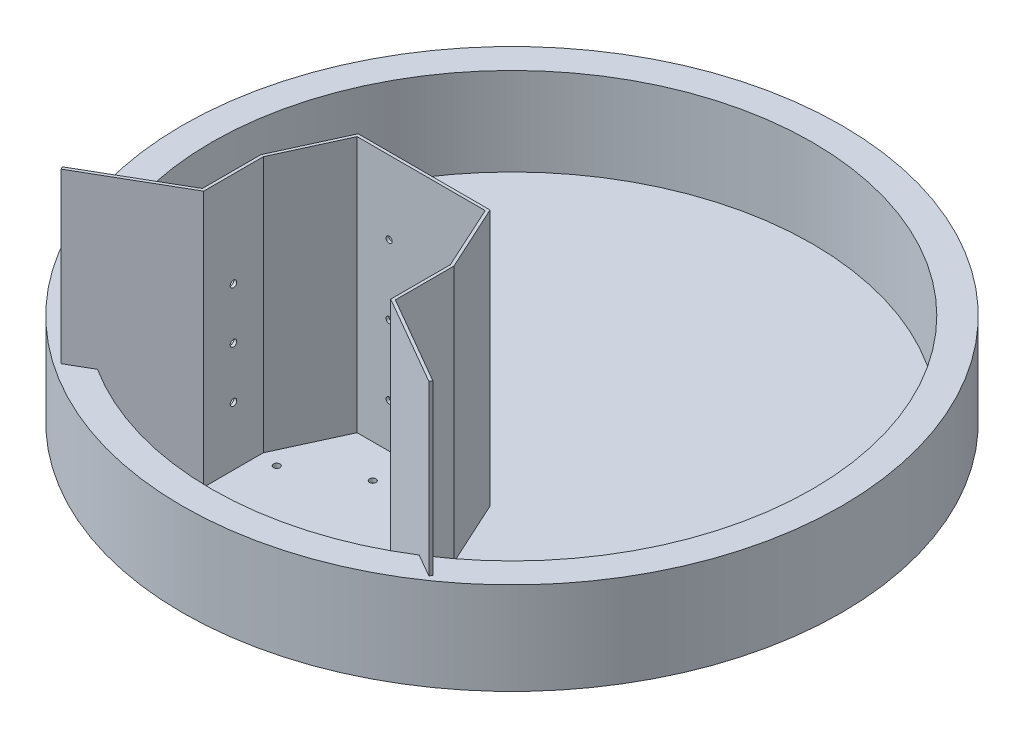
from build123d import *

# Parameters (mm, degrees)
EXTRUDE_THIN1_DEPTH = 175
CUT_EXTRUDE1_REACH  = 249.104
SKETCH2_R           = 2.1
CUT_EXTRUDE2_REACH  = 224.775
SKETCH3_R           = 2.25
SKETCH4_R           = 225
BOSS_EXTRUDE1_DEPTH = 3
SKETCH5_R           = 2.2
CUT_EXTRUDE3_DEPTH  = 3
BOSS_EXTRUDE2_START = 60
SKETCH6_R           = 225
SKETCH6_R_2         = 205
BOSS_EXTRUDE2_DEPTH = 60


with BuildPart() as part:
    # Sketch1 → Extrude-Thin1 (new body)
    with BuildSketch(Plane(origin=(0, 0, 0), x_dir=(1, 0, 0), z_dir=(0, 1, 0))):
        Polygon((0, 0), (-45, 0), (-65.833333333, -45.452967144), (-65.833333333, -85.452967144), (-126.455111598, -120.452967144), (-125.455111598, -122.185017952), (-63.833333333, -86.607667683), (-63.833333333, -45.889482298), (-43.716622104, -2), (0, -2), align=None)
    extrude_thin1 = extrude(amount=EXTRUDE_THIN1_DEPTH)

    # Sketch2 → Cut-Extrude1 (cut, up to next)
    with BuildSketch(Plane.XY.offset(2), mode=Mode.PRIVATE) as cut_extrude1_sk1:
        with Locations((-21.858311052, 30)):
            Circle(SKETCH2_R)
    cut_extrude1_tool1 = extrude(cut_extrude1_sk1.sketch, amount=-CUT_EXTRUDE1_REACH, mode=Mode.PRIVATE) & part.part
    # Sketch2 → Cut-Extrude1 (cut, up to next)
    with BuildSketch(Plane.XY.offset(2), mode=Mode.PRIVATE) as cut_extrude1_sk2:
        with Locations((-21.858311052, 77.5)):
            Circle(SKETCH2_R)
    cut_extrude1_tool2 = extrude(cut_extrude1_sk2.sketch, amount=-CUT_EXTRUDE1_REACH, mode=Mode.PRIVATE) & part.part
    # Sketch2 → Cut-Extrude1 (cut, up to next)
    with BuildSketch(Plane.XY.offset(2), mode=Mode.PRIVATE) as cut_extrude1_sk3:
        with Locations((-21.858311052, 125)):
            Circle(SKETCH2_R)
    cut_extrude1_tool3 = extrude(cut_extrude1_sk3.sketch, amount=-CUT_EXTRUDE1_REACH, mode=Mode.PRIVATE) & part.part
    cut_extrude1_1 = cut_extrude1_tool1.solids().sort_by_distance((-21.858311, 30, 2))[0]
    add(cut_extrude1_1, mode=Mode.SUBTRACT)
    cut_extrude1_2 = cut_extrude1_tool2.solids().sort_by_distance((-21.858311, 77.5, 2))[0]
    add(cut_extrude1_2, mode=Mode.SUBTRACT)
    cut_extrude1_3 = cut_extrude1_tool3.solids().sort_by_distance((-21.858311, 125, 2))[0]
    add(cut_extrude1_3, mode=Mode.SUBTRACT)
    cut_extrude1 = cut_extrude1_1 + cut_extrude1_2 + cut_extrude1_3  # Cut-Extrude1 as one shape, for the pattern or mirror that repeats it

    # Sketch3 → Cut-Extrude2 (cut, up to next)
    with BuildSketch(Plane(origin=(-63.833333333, 0, 0), x_dir=(0, 0, -1), z_dir=(1, 0, 0)), mode=Mode.PRIVATE) as cut_extrude2_sk1:
        with Locations((-66.248574991, 40)):
            Circle(SKETCH3_R)
    cut_extrude2_tool1 = extrude(cut_extrude2_sk1.sketch, amount=-CUT_EXTRUDE2_REACH, mode=Mode.PRIVATE) & part.part
    # Sketch3 → Cut-Extrude2 (cut, up to next)
    with BuildSketch(Plane(origin=(-63.833333333, 0, 0), x_dir=(0, 0, -1), z_dir=(1, 0, 0)), mode=Mode.PRIVATE) as cut_extrude2_sk2:
        with Locations((-66.248574991, 75)):
            Circle(SKETCH3_R)
    cut_extrude2_tool2 = extrude(cut_extrude2_sk2.sketch, amount=-CUT_EXTRUDE2_REACH, mode=Mode.PRIVATE) & part.part
    # Sketch3 → Cut-Extrude2 (cut, up to next)
    with BuildSketch(Plane(origin=(-63.833333333, 0, 0), x_dir=(0, 0, -1), z_dir=(1, 0, 0)), mode=Mode.PRIVATE) as cut_extrude2_sk3:
        with Locations((-66.248574991, 110)):
            Circle(SKETCH3_R)
    cut_extrude2_tool3 = extrude(cut_extrude2_sk3.sketch, amount=-CUT_EXTRUDE2_REACH, mode=Mode.PRIVATE) & part.part
    cut_extrude2_1 = cut_extrude2_tool1.solids().sort_by_distance((-63.833333, 40, 66.248575))[0]
    add(cut_extrude2_1, mode=Mode.SUBTRACT)
    cut_extrude2_2 = cut_extrude2_tool2.solids().sort_by_distance((-63.833333, 75, 66.248575))[0]
    add(cut_extrude2_2, mode=Mode.SUBTRACT)
    cut_extrude2_3 = cut_extrude2_tool3.solids().sort_by_distance((-63.833333, 110, 66.248575))[0]
    add(cut_extrude2_3, mode=Mode.SUBTRACT)
    cut_extrude2 = cut_extrude2_1 + cut_extrude2_2 + cut_extrude2_3  # Cut-Extrude2 as one shape, for the pattern or mirror that repeats it

    # Mirror1: Extrude-Thin1, Cut-Extrude1, Cut-Extrude2 across plane
    add(extrude_thin1.mirror(Plane(origin=(0, 0, 0), x_dir=(0, 0, 1), z_dir=(1, 0, 0))))
    add(cut_extrude1.mirror(Plane(origin=(0, 0, 0), x_dir=(0, 0, 1), z_dir=(1, 0, 0))), mode=Mode.SUBTRACT)
    add(cut_extrude2.mirror(Plane(origin=(0, 0, 0), x_dir=(0, 0, 1), z_dir=(1, 0, 0))), mode=Mode.SUBTRACT)

    # Sketch4 → Boss-Extrude1 (add)
    with BuildSketch(Plane.XZ):
        with Locations(Location((0, -60, 0), (0, 0, 270))):
            Circle(SKETCH4_R)
    extrude(amount=BOSS_EXTRUDE1_DEPTH)

    # Sketch5 → Cut-Extrude3 (cut)
    with BuildSketch(Plane(origin=(0, 0, 0), x_dir=(1, 0, 0), z_dir=(0, 1, 0))):
        with Locations(Location((-10, -25, 0), (0, 0, 270))):
            Circle(SKETCH5_R)
        with Locations(Location((43.5, -117.664718205, 0), (0, 0, 270))):
            Circle(SKETCH5_R)
        with Locations(Location((1.930780618, -141.664718205, 0), (0, 0, 270))):
            Circle(SKETCH5_R)
        with Locations(Location((-51.569219382, -49, 0), (0, 0, 270))):
            Circle(SKETCH5_R)
    extrude(amount=-CUT_EXTRUDE3_DEPTH, mode=Mode.SUBTRACT)

    # Sketch6 → Boss-Extrude2 (add)
    with BuildSketch(Plane(origin=(0, 0, 0), x_dir=(1, 0, 0), z_dir=(0, 1, 0)).offset(BOSS_EXTRUDE2_START)):
        with Locations(Location((0, 60, 0), (0, 0, 270))):
            Circle(SKETCH6_R)
        with Locations((0, 60)):
            Circle(SKETCH6_R_2, mode=Mode.SUBTRACT)
    extrude(amount=-BOSS_EXTRUDE2_DEPTH)


solid = part.part
